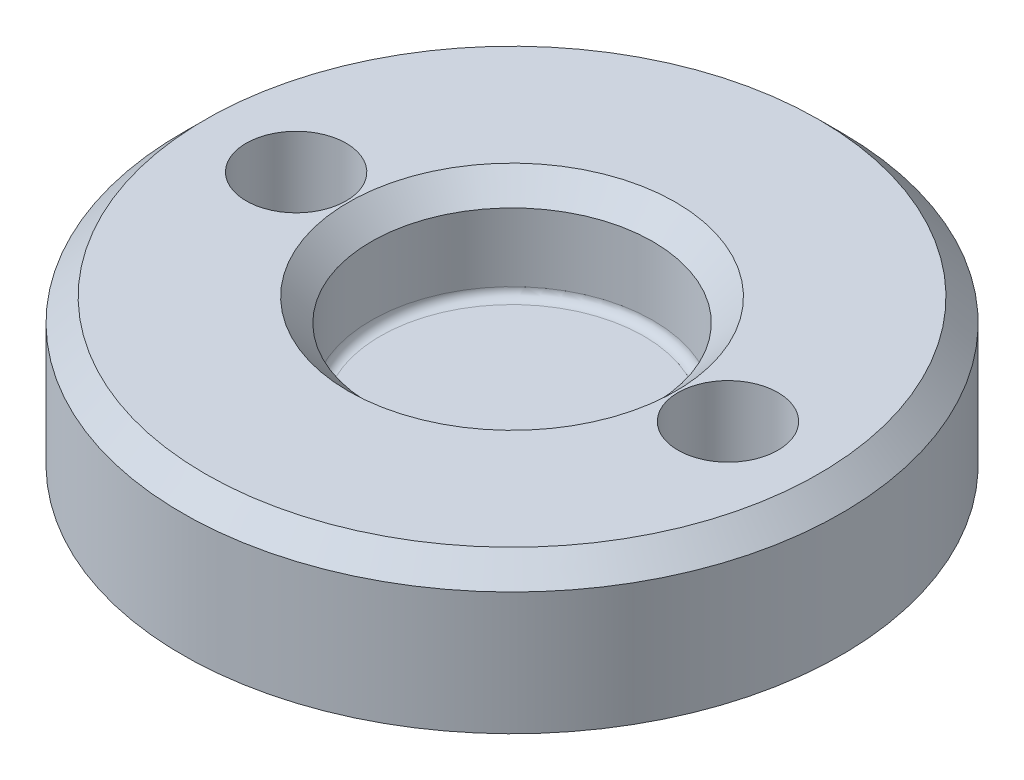
from build123d import *

# Parameters (mm, degrees)
CHAMFER2_SIZE     = 0.5
CIRPATTERN1_COUNT = 2
CHAMFER3_SIZE     = 0.5
FILLET2_R         = 0.2


with BuildPart() as part:
    # Sketch1 → Revolve1 (revolve)
    with BuildSketch(Plane.XY, mode=Mode.PRIVATE) as revolve1_sk:
        Polygon((0, 0), (-7.25, 0), (-7.25, 3.2), (-3.1, 3.2), (-3.1, 1), (0, 1), align=None)
    revolve(revolve1_sk.sketch.rotate(Axis((0, 0, 0), (0, 1, 0)), 270), axis=Axis((0, 0, 0), (0, 1, 0)))

    # Chamfer2
    chamfer2_edges = [part.edges().sort_by_distance(p)[0] for p in [
        (0, 3.2, 3.1),
    ]]
    chamfer(chamfer2_edges, length=CHAMFER2_SIZE)

    # Sketch4 → CSK for M2 Flat Head Machine Screw1 (revolve, cut)
    with BuildSketch(Plane(origin=(-4.75, 0, 0), x_dir=(0, 0, -1), z_dir=(1, 0, 0))):
        Polygon((0, 0), (0, 5.660946681), (1.1, 5), (1.1, 1.1), (2.2, 0), align=None)
    csk_for_m2_flat_head_machine_screw1 = revolve(axis=Axis((-4.75, -6.35, 0), (0, 1, 0)), mode=Mode.SUBTRACT)

    # CirPattern1: CSK for M2 Flat Head Machine Screw1 ×2 about axis
    cirpattern1_axis = Axis((0, 0, 0), (0, 1, 0))
    for i in range(1, CIRPATTERN1_COUNT):
        add(csk_for_m2_flat_head_machine_screw1.rotate(cirpattern1_axis, i * 360 / CIRPATTERN1_COUNT), mode=Mode.SUBTRACT)

    # Chamfer3
    chamfer3_edges = [part.edges().sort_by_distance(p)[0] for p in [
        (0, 3.2, 7.25),
    ]]
    chamfer(chamfer3_edges, length=CHAMFER3_SIZE)

    # Fillet2
    fillet2_edges = [part.edges().sort_by_distance(p)[0] for p in [
        (0, 1, 3.1),
    ]]
    fillet(fillet2_edges, radius=FILLET2_R)


solid = part.part
